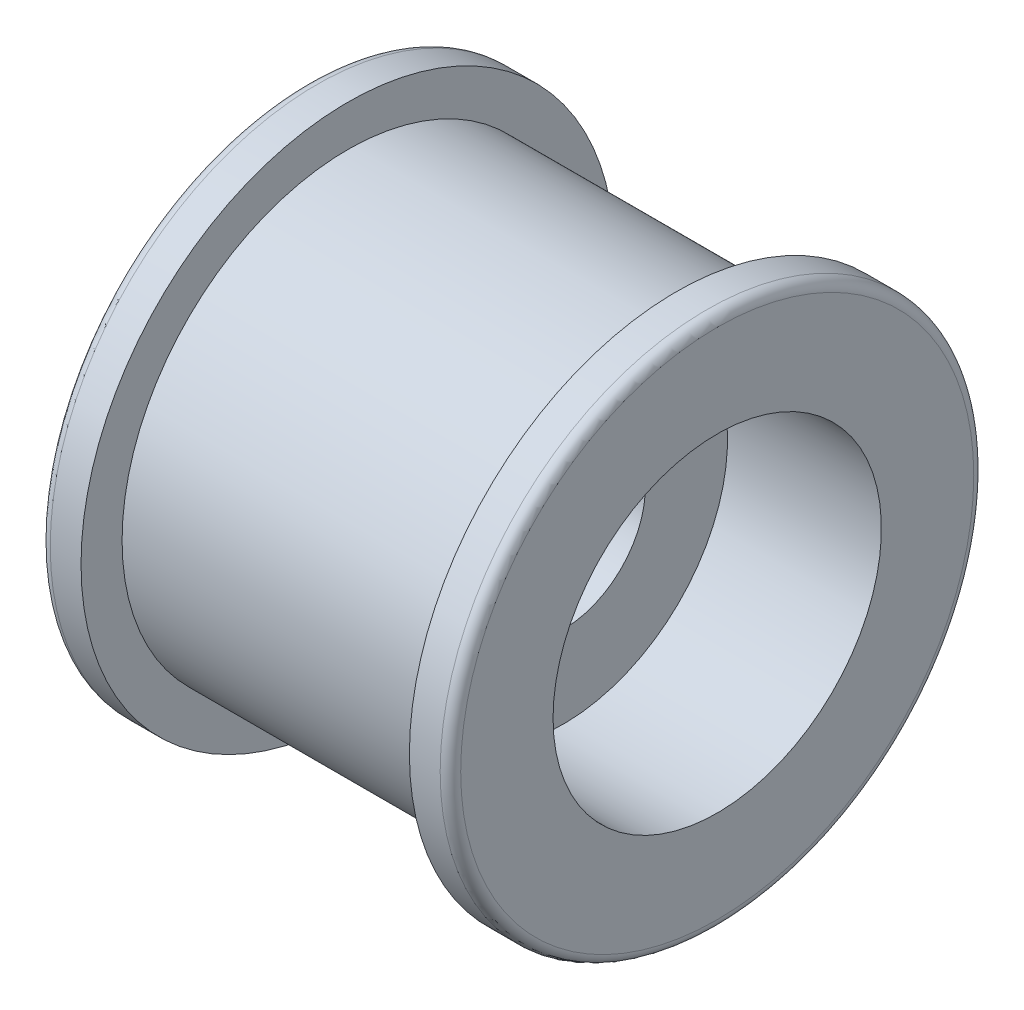
from build123d import *

# Parameters (mm, degrees)
FILLET2_R = 0.5


with BuildPart() as part:
    # Sketch1 → Revolve1 (revolve)
    with BuildSketch(Plane.XY, mode=Mode.PRIVATE) as revolve1_sk:
        Polygon((19.969555077, 4), (19.969555077, 7), (19.969555077, 9), (17.969555077, 9), (17.969555077, 7), (1.969555077, 7), (1.969555077, 9), (-0.030444923, 9), (-0.030444923, 7), (-0.030444923, 4), (7.469555077, 4), (7.469555077, 0), (12.469555077, 0), (12.469555077, 4), align=None)
    revolve(revolve1_sk.sketch.rotate(Axis((-15.251224144, -4, 0), (1, 0, 0)), 90), axis=Axis((-15.251224144, -4, 0), (1, 0, 0)))

    # Fillet2
    fillet2_edges = [part.edges().sort_by_distance(p)[0] for p in [
        (19.969555077, -4, -13),
        (-0.030444923, -4, -13),
    ]]
    fillet(fillet2_edges, radius=FILLET2_R)


solid = part.part
